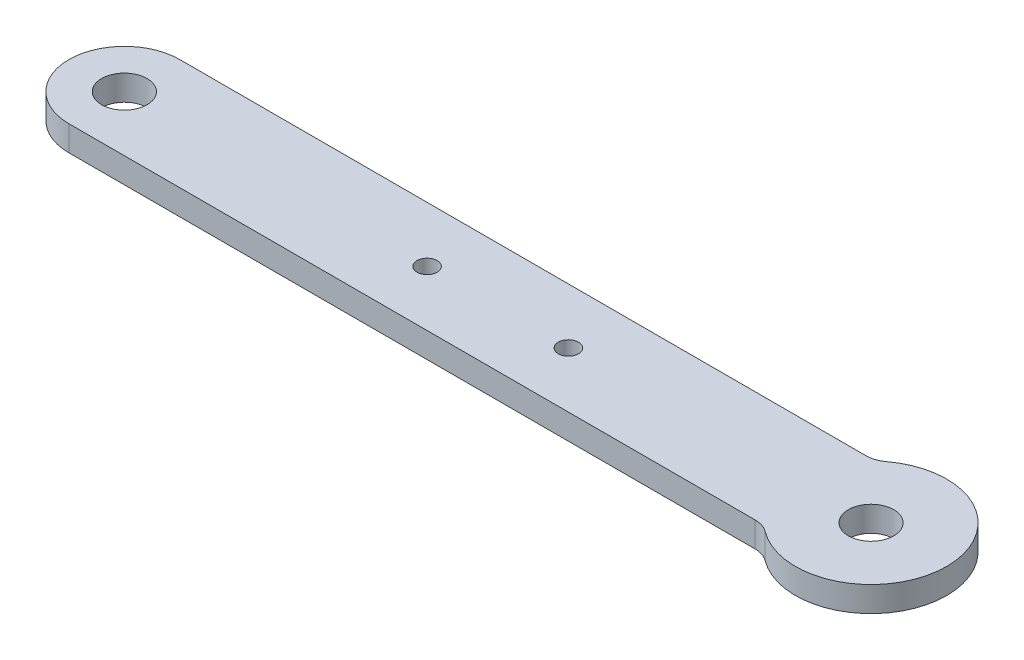
from build123d import *

# Parameters (mm, degrees)
SKETCH_1_R      = 4.5
SKETCH_1_R_2    = 2
EXTRUDE_1_DEPTH = 5


with BuildPart() as part:
    # 草图1 → 凸台-拉伸1 (new body)
    with BuildSketch(Plane(origin=(0, 0, 0), x_dir=(1, 0, 0), z_dir=(0, 1, 0))):
        with BuildLine():
            Line((-64.232662192, 19.03803132), (71.767337808, 19.03803132))
            ThreePointArc((71.767337808, 19.03803132), (73.348476638, 19.29461483), (74.767337808, 20.03803132))
            ThreePointArc((74.767337808, 20.03803132), (98.767337808, 8.03803132), (74.767337808, -3.96196868))
            ThreePointArc((74.767337808, -3.96196868), (73.348476638, -3.21855219), (71.767337808, -2.96196868))
            Line((71.767337808, -2.96196868), (-64.232662192, -2.96196868))
            ThreePointArc((-64.232662192, -2.96196868), (-75.232662192, 8.03803132), (-64.232662192, 19.03803132))
        make_face()
        with Locations(Location((-64.232662192, 8.03803132, 0), (0, 0, 270))):
            Circle(SKETCH_1_R, mode=Mode.SUBTRACT)
        with Locations(Location((83.767337808, 8.03803132, 0), (0, 0, 270))):
            Circle(SKETCH_1_R, mode=Mode.SUBTRACT)
        with Locations(Location((-4.232662192, 8.03803132, 0), (0, 0, 270))):
            Circle(SKETCH_1_R_2, mode=Mode.SUBTRACT)
        with Locations(Location((23.767337808, 8.03803132, 0), (0, 0, 270))):
            Circle(SKETCH_1_R_2, mode=Mode.SUBTRACT)
    extrude(amount=EXTRUDE_1_DEPTH)


solid = part.part
